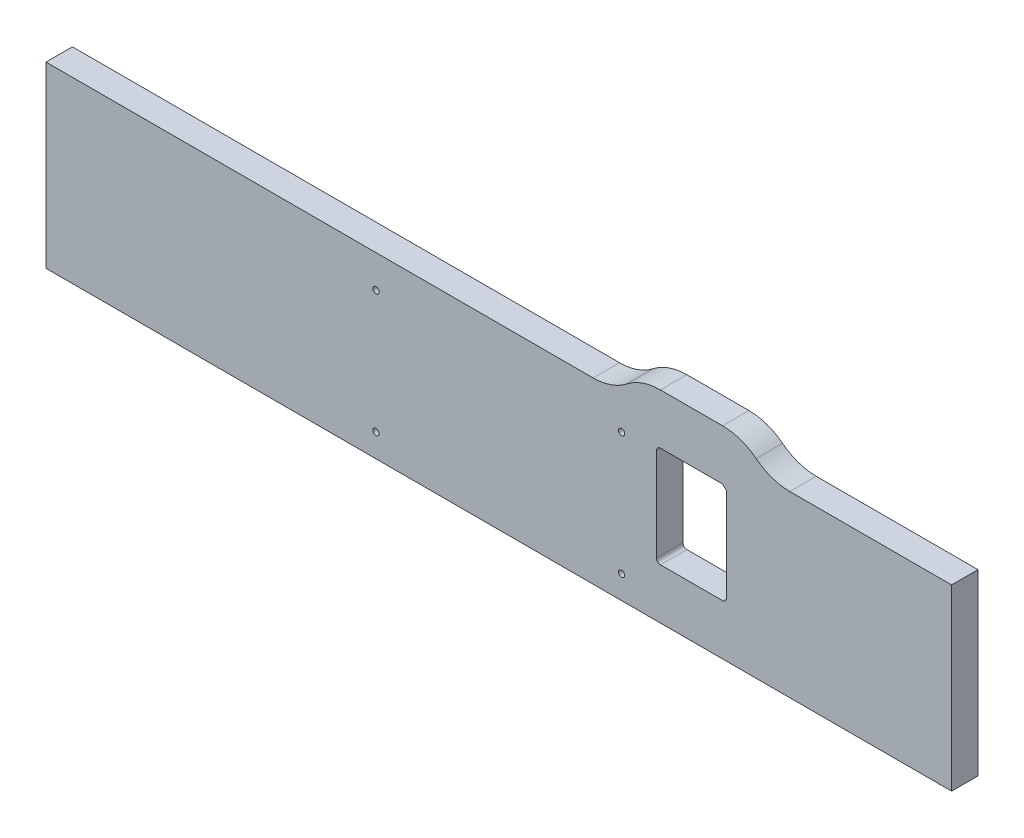
from build123d import *

# Parameters (mm, degrees)
EXTRUDE1_DEPTH     = 21.59
SKETCH3_R          = 2.54
CUT_EXTRUDE1_DEPTH = 21.59


with BuildPart() as part:
    # Sketch2 → Extrude1 (new body)
    with BuildSketch(Plane.XY):
        with BuildLine():
            Line((137.16, -6013.450000001), (-603.25, -6013.450000001))
            Line((-603.25, -6013.450000001), (-603.25, -5867.400000001))
            Line((-603.25, -5867.400000001), (-155.878238141, -5867.400000001))
            ThreePointArc((-155.878238141, -5867.400000001), (-141.328560309, -5864.951302064), (-128.38193157, -5857.875))
            ThreePointArc((-128.38193157, -5857.875), (-115.435302831, -5850.798697937), (-100.885625, -5848.35))
            Line((-100.885625, -5848.35), (-50.085625, -5848.35))
            ThreePointArc((-50.085625, -5848.35), (-35.535947169, -5850.798697937), (-22.58931843, -5857.875))
            ThreePointArc((-22.58931843, -5857.875), (-9.642689691, -5864.951302063), (4.906988141, -5867.400000001))
            Line((4.906988141, -5867.400000001), (137.16, -5867.400000001))
            Line((137.16, -5867.400000001), (137.16, -6013.450000001))
        make_face()
    extrude(amount=-EXTRUDE1_DEPTH)

    # Sketch3 → Cut-Extrude1 (cut)
    with BuildSketch(Plane.XY):
        with Locations((-333.454375, -5994.4)):
            Circle(SKETCH3_R)
        with Locations((-132.635625, -5994.4)):
            Circle(SKETCH3_R)
        with Locations((-132.635625, -5894.07)):
            Circle(SKETCH3_R)
        with Locations((-333.454375, -5894.07)):
            Circle(SKETCH3_R)
        with BuildLine():
            Line((-104.060625, -5892.8), (-104.060625, -5969))
            ThreePointArc((-104.060625, -5969), (-103.13068903, -5971.24506403), (-100.885625, -5972.175))
            Line((-100.885625, -5972.175), (-50.085625, -5972.175))
            ThreePointArc((-50.085625, -5972.175), (-47.84056097, -5971.24506403), (-46.910625, -5969))
            Line((-46.910625, -5969), (-46.910625, -5892.8))
            Line((-46.910625, -5892.8), (-50.085625, -5889.625))
            Line((-50.085625, -5889.625), (-100.885625, -5889.625))
            ThreePointArc((-100.885625, -5889.625), (-103.13068903, -5890.55493597), (-104.060625, -5892.8))
        make_face()
    extrude(amount=-CUT_EXTRUDE1_DEPTH, mode=Mode.SUBTRACT)


solid = part.part
